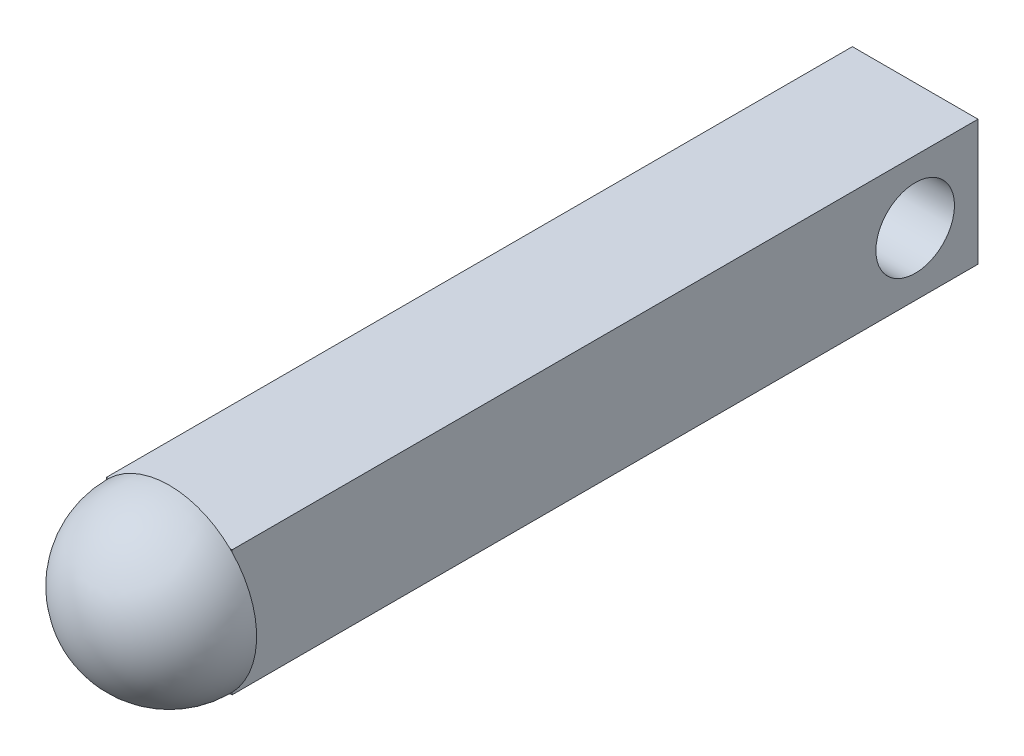
from build123d import *

# Parameters (mm, degrees)
SKETCH1_W           = 16
SKETCH1_H           = 16
BOSS_EXTRUDE1_DEPTH = 95
SKETCH2_R           = 5
CUT_EXTRUDE1_DEPTH  = 75


with BuildPart() as part:
    # Sketch1 → Boss-Extrude1 (new body)
    with BuildSketch(Plane.XY):
        Rectangle(SKETCH1_W, SKETCH1_H)
    extrude(amount=BOSS_EXTRUDE1_DEPTH)

    # Sketch2 → Cut-Extrude1 (cut)
    with BuildSketch(Plane.ZY.offset(8)):
        with Locations((8, 0)):
            Circle(SKETCH2_R)
    extrude(amount=-CUT_EXTRUDE1_DEPTH, mode=Mode.SUBTRACT)

    # Sketch3 → Revolve1 (revolve)
    with BuildSketch(Plane(origin=(0, 0, 0), x_dir=(0, 0, -1), z_dir=(1, 0, 0))):
        with BuildLine():
            Line((-95, 11.12523004), (-95, 0))
            Line((-95, 0), (-106.12523004, 0))
            ThreePointArc((-106.12523004, 0), (-102.866725603, 7.866725603), (-95, 11.12523004))
        make_face()
    revolve(axis=Axis((0, 0, 95), (0, 0, 1)))


solid = part.part
